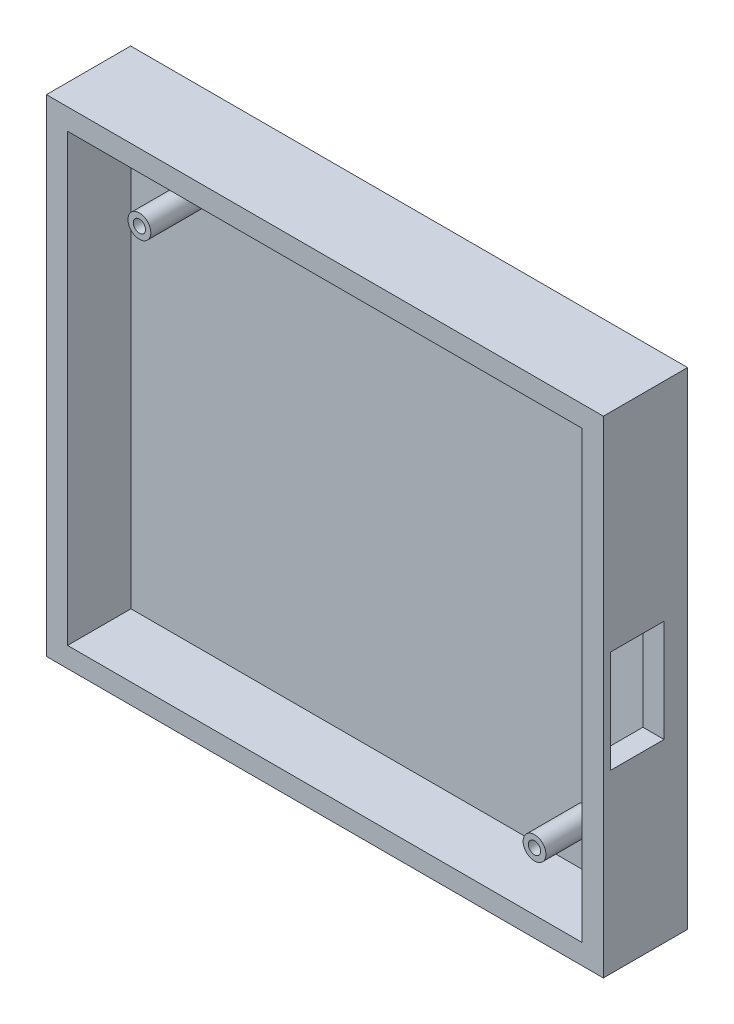
from build123d import *

# Parameters (mm, degrees)
SKETCH1_W           = 123.686846594
SKETCH1_H           = 107.02436985
BOSS_EXTRUDE2_DEPTH = 5
SKETCH2_W           = 133.846846594
SKETCH2_H           = 116.939920661
SKETCH2_W_2         = 123.686846594
SKETCH2_H_2         = 107.02436985
BOSS_EXTRUDE4_DEPTH = 20.24
SKETCH4_R           = 2.745
SKETCH4_R_2         = 1.475
BOSS_EXTRUDE5_DEPTH = 12.62
SKETCH5_W           = 12.83643861
SKETCH5_H           = 24.624173529
CUT_EXTRUDE3_DEPTH  = 10


with BuildPart() as part:
    # Sketch1 → Boss-Extrude2 (new body)
    with BuildSketch(Plane(origin=(0, 0, 1258.652497842), x_dir=(-1, 0, 0), z_dir=(0, 0, -1))):
        with Locations((-654.528433331, 841.068613897)):
            Rectangle(SKETCH1_W, SKETCH1_H)
    extrude(amount=-BOSS_EXTRUDE2_DEPTH)

    # Sketch2 → Boss-Extrude4 (add)
    with BuildSketch(Plane(origin=(0, 0, 1258.652497842), x_dir=(-1, 0, 0), z_dir=(0, 0, -1))):
        with Locations((-654.528433331, 841.190838492)):
            Rectangle(SKETCH2_W, SKETCH2_H)
        with Locations((-654.528433331, 841.068613897)):
            Rectangle(SKETCH2_W_2, SKETCH2_H_2, mode=Mode.SUBTRACT)
    extrude(amount=-BOSS_EXTRUDE4_DEPTH)

    # Sketch4 → Boss-Extrude5 (add)
    # profile 1 of 2: a face of its own
    with BuildSketch(Plane.XY.offset(1263.652497842)):
        with Locations(Location((607.327962296, 880.84094357, 0), (0, 0, 180))):
            Circle(SKETCH4_R)
        with Locations((607.327962296, 880.84094357)):
            Circle(SKETCH4_R_2, mode=Mode.SUBTRACT)
    # profile 2 of 2: a face of its own
    with BuildSketch(Plane.XY.offset(1263.652497842)):
        with Locations(Location((702.289411045, 798.927110343, 0), (0, 0, 180))):
            Circle(SKETCH4_R)
        with Locations((702.289411045, 798.927110343)):
            Circle(SKETCH4_R_2, mode=Mode.SUBTRACT)
    extrude(amount=BOSS_EXTRUDE5_DEPTH)

    # Sketch5 → Cut-Extrude3 (cut)
    with BuildSketch(Plane(origin=(721.451856628, 0, 0), x_dir=(0, 0, -1), z_dir=(1, 0, 0))):
        with Locations((-1270.719437851, 837.387376974)):
            Rectangle(SKETCH5_W, SKETCH5_H)
    extrude(amount=-CUT_EXTRUDE3_DEPTH, mode=Mode.SUBTRACT)


solid = part.part
